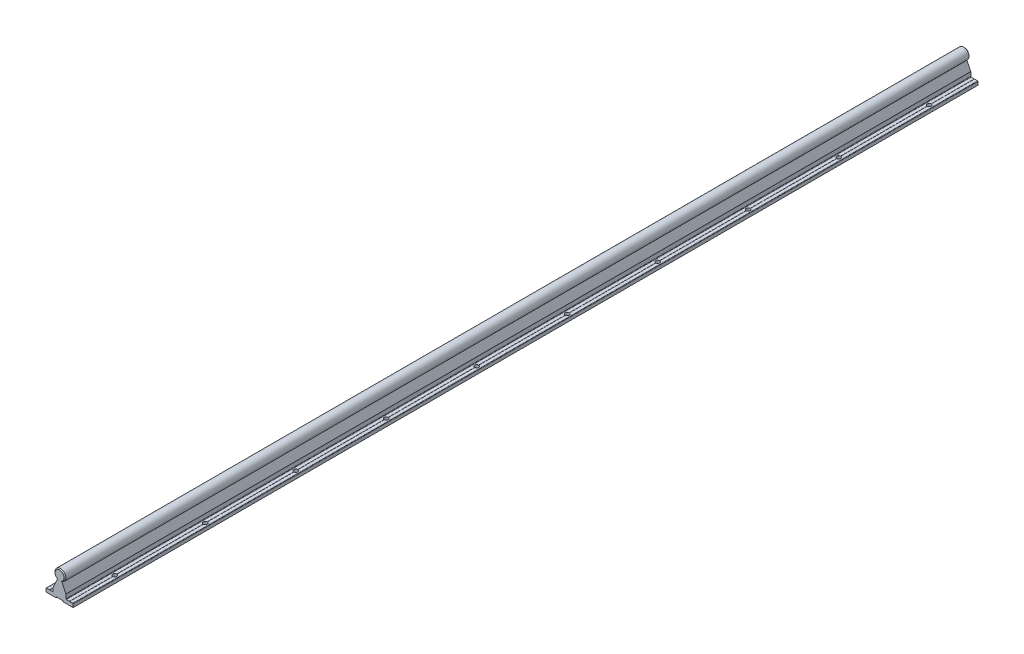
from build123d import *

# Parameters (mm, degrees)
BOSS_EXTRU_1_DEPTH         = 1000
CHANFREIN5_SIZE            = 1
CHANFREIN6_SIZE            = 1
ENL_V_MAT_EXTRU_1_REACH    = 1002.885
ESQUISSE2_R                = 2.25
R_P_TITION_LIN_AIRE1_COUNT = 9
R_P_TITION_LIN_AIRE1_PITCH = 100


with BuildPart() as part:
    # Esquisse1 → Boss.-Extru.1 (new body)
    with BuildSketch(Plane.XY):
        with BuildLine():
            Line((0, 0), (0, 3.5))
            ThreePointArc((0, 3.5), (0.146446609, 3.853553391), (0.5, 4))
            Line((0.5, 4), (3.9, 4))
            Line((3.9, 4), (3.9, 3.8))
            Line((3.9, 3.8), (4.1, 3.8))
            Line((4.1, 3.8), (4.1, 4))
            Line((4.1, 4), (7.5, 4))
            ThreePointArc((7.5, 4), (7.853553391, 4.146446609), (8, 4.5))
            Line((8, 4.5), (8, 8.885625558))
            ThreePointArc((8, 8.885625558), (8.012589542, 8.997120156), (8.049724182, 9.103000091))
            Line((8.049724182, 9.103000091), (12.391505605, 18.096690182))
            ThreePointArc((12.391505605, 18.096690182), (15, 29.5), (17.608494395, 18.096690182))
            Line((17.608494395, 18.096690182), (21.950275818, 9.103000091))
            ThreePointArc((21.950275818, 9.103000091), (21.987410458, 8.997120156), (22, 8.885625558))
            Line((22, 8.885625558), (22, 4.5))
            ThreePointArc((22, 4.5), (22.146446609, 4.146446609), (22.5, 4))
            Line((22.5, 4), (25.9, 4))
            Line((25.9, 4), (25.9, 3.8))
            Line((25.9, 3.8), (26.1, 3.8))
            Line((26.1, 3.8), (26.1, 4))
            Line((26.1, 4), (29.5, 4))
            ThreePointArc((29.5, 4), (29.853553391, 3.853553391), (30, 3.5))
            Line((30, 3.5), (30, 0))
            Line((30, 0), (19, 0))
            Line((19, 0), (19, 0.5))
            ThreePointArc((19, 0.5), (18.853553391, 0.853553391), (18.5, 1))
            Line((18.5, 1), (11.5, 1))
            ThreePointArc((11.5, 1), (11.146446609, 0.853553391), (11, 0.5))
            Line((11, 0.5), (11, 0))
            Line((11, 0), (0, 0))
        make_face()
    extrude(amount=BOSS_EXTRU_1_DEPTH)

    # Chanfrein5
    chanfrein5_edges = [part.edges().sort_by_distance(p)[0] for p in [
        (15, 29.5, 0),
    ]]
    chamfer(chanfrein5_edges, length=CHANFREIN5_SIZE)

    # Chanfrein6
    chanfrein6_edges = [part.edges().sort_by_distance(p)[0] for p in [
        (15, 29.5, 1000),
    ]]
    chamfer(chanfrein6_edges, length=CHANFREIN6_SIZE)

    # Esquisse2 → Enlèv. mat.-Extru.1 (cut, up to next)
    with BuildSketch(Plane.XZ, mode=Mode.PRIVATE) as enl_v_mat_extru_1_sk1:
        with Locations(Location((4, 850, 0), (0, 0, 270))):
            Circle(ESQUISSE2_R)
    enl_v_mat_extru_1_tool1 = extrude(enl_v_mat_extru_1_sk1.sketch, amount=-ENL_V_MAT_EXTRU_1_REACH, mode=Mode.PRIVATE) & part.part
    # Esquisse2 → Enlèv. mat.-Extru.1 (cut, up to next)
    with BuildSketch(Plane.XZ, mode=Mode.PRIVATE) as enl_v_mat_extru_1_sk2:
        with Locations(Location((26, 850, 0), (0, 0, 270))):
            Circle(ESQUISSE2_R)
    enl_v_mat_extru_1_tool2 = extrude(enl_v_mat_extru_1_sk2.sketch, amount=-ENL_V_MAT_EXTRU_1_REACH, mode=Mode.PRIVATE) & part.part
    # Esquisse2 → Enlèv. mat.-Extru.1 (cut, up to next)
    with BuildSketch(Plane.XZ, mode=Mode.PRIVATE) as enl_v_mat_extru_1_sk3:
        with Locations(Location((26, 950, 0), (0, 0, 270))):
            Circle(ESQUISSE2_R)
    enl_v_mat_extru_1_tool3 = extrude(enl_v_mat_extru_1_sk3.sketch, amount=-ENL_V_MAT_EXTRU_1_REACH, mode=Mode.PRIVATE) & part.part
    # Esquisse2 → Enlèv. mat.-Extru.1 (cut, up to next)
    with BuildSketch(Plane.XZ, mode=Mode.PRIVATE) as enl_v_mat_extru_1_sk4:
        with Locations(Location((4, 950, 0), (0, 0, 270))):
            Circle(ESQUISSE2_R)
    enl_v_mat_extru_1_tool4 = extrude(enl_v_mat_extru_1_sk4.sketch, amount=-ENL_V_MAT_EXTRU_1_REACH, mode=Mode.PRIVATE) & part.part
    enl_v_mat_extru_1_1 = enl_v_mat_extru_1_tool1.solids().sort_by_distance((4, 0, 850))[0]
    add(enl_v_mat_extru_1_1, mode=Mode.SUBTRACT)
    enl_v_mat_extru_1_2 = enl_v_mat_extru_1_tool2.solids().sort_by_distance((26, 0, 850))[0]
    add(enl_v_mat_extru_1_2, mode=Mode.SUBTRACT)
    enl_v_mat_extru_1_3 = enl_v_mat_extru_1_tool3.solids().sort_by_distance((26, 0, 950))[0]
    add(enl_v_mat_extru_1_3, mode=Mode.SUBTRACT)
    enl_v_mat_extru_1_4 = enl_v_mat_extru_1_tool4.solids().sort_by_distance((4, 0, 950))[0]
    add(enl_v_mat_extru_1_4, mode=Mode.SUBTRACT)
    enl_v_mat_extru_1 = enl_v_mat_extru_1_1 + enl_v_mat_extru_1_2 + enl_v_mat_extru_1_3 + enl_v_mat_extru_1_4  # Enlèv. mat.-Extru.1 as one shape, for the pattern or mirror that repeats it

    # Répétition linéaire1: Enlèv. mat.-Extru.1 ×9
    with Locations(*[(0, 0, -i * R_P_TITION_LIN_AIRE1_PITCH) for i in range(1, R_P_TITION_LIN_AIRE1_COUNT)]):
        add(enl_v_mat_extru_1, mode=Mode.SUBTRACT)


solid = part.part
